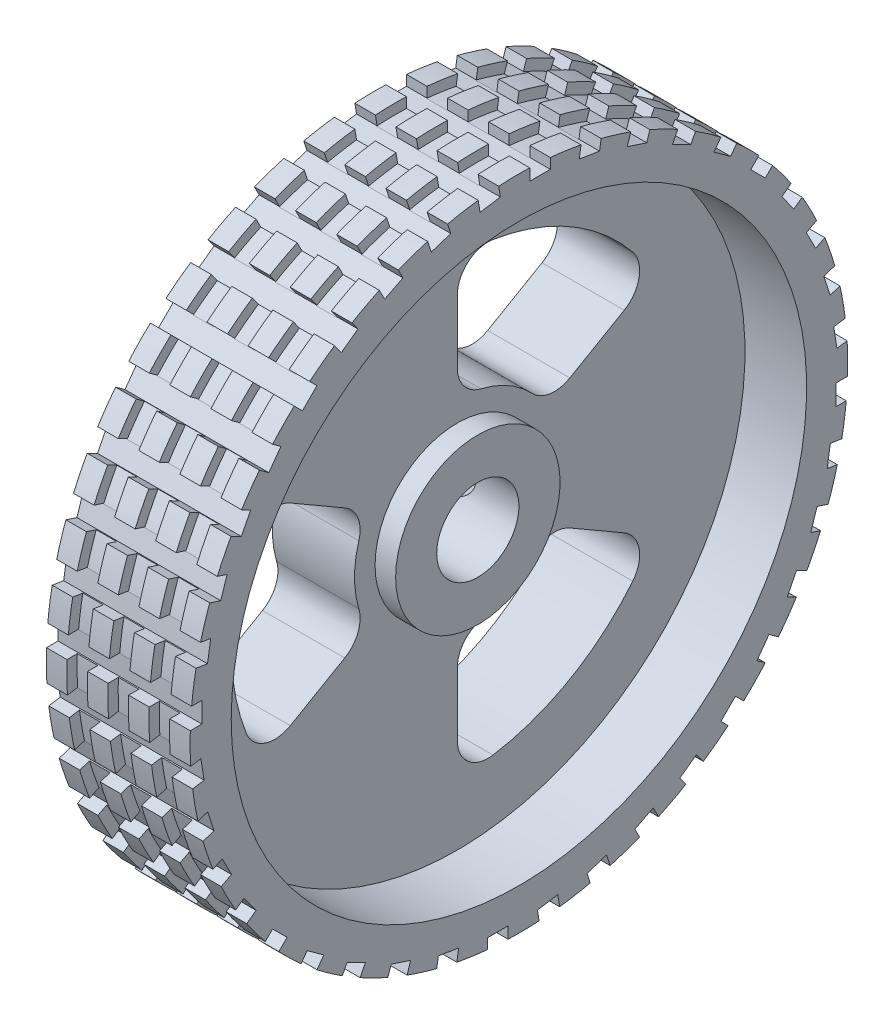
from build123d import *

# Parameters (mm, degrees)
CUT_EXTRUDE1_DEPTH = 23.978250743
CIRPATTERN1_COUNT  = 3
CUT_EXTRUDE2_DEPTH = 24.685438729
CIRPATTERN2_COUNT  = 40
SKETCH6_W          = 1
SKETCH6_H          = 0.5
LPATTERN1_COUNT    = 3
LPATTERN1_PITCH    = 2


with BuildPart() as part:
    # Sketch1 → Revolve1 (revolve)
    with BuildSketch(Plane.XY, mode=Mode.PRIVATE) as revolve1_sk:
        Polygon((0, 2), (5, 2), (5, 4), (4, 4), (4, 14), (7, 14), (7, 16), (0, 16), align=None)
    revolve(revolve1_sk.sketch.rotate(Axis((0, 0, 0), (1, 0, 0)), 90), axis=Axis((0, 0, 0), (1, 0, 0)))

    # Sketch2 → Cut-Revolve1 (revolve, cut)
    with BuildSketch(Plane(origin=(0, 0, 0), x_dir=(1, 0, 0), z_dir=(0, 1, 0)), mode=Mode.PRIVATE) as cut_revolve1_sk:
        Polygon((2.9, 0), (2.9, 11.5), (3.5, 11.5), (3.5, 16), (2, 16), (2, 0), align=None)
    revolve(cut_revolve1_sk.sketch.rotate(Axis((2, 0, -16), (0, 0, 1)), 180), axis=Axis((2, 0, -16), (0, 0, 1)), mode=Mode.SUBTRACT)

    # Sketch4 → Cut-Extrude1 (cut, through all)
    with BuildSketch(Plane(origin=(4, 0, 0), x_dir=(0, 0, -1), z_dir=(1, 0, 0))):
        with BuildLine():
            Line((-8.124038405, 4.69041576), (-5.477225575, 3.16227766))
            ThreePointArc((-5.477225575, 3.16227766), (-4.833247936, 2.417158631), (-4.790173519, 1.433261196))
            ThreePointArc((-4.790173519, 1.433261196), (-5, 0), (-4.790173519, -1.433261196))
            ThreePointArc((-4.790173519, -1.433261196), (-4.833247936, -2.417158631), (-5.477225575, -3.16227766))
            Line((-5.477225575, -3.16227766), (-8.124038405, -4.69041576))
            ThreePointArc((-8.124038405, -4.69041576), (-9.375793933, -4.804969317), (-10.275202363, -3.926858336))
            ThreePointArc((-10.275202363, -3.926858336), (-11, 0), (-10.275202363, 3.926858336))
            ThreePointArc((-10.275202363, 3.926858336), (-9.375793933, 4.804969317), (-8.124038405, 4.69041576))
        make_face()
    cut_extrude1 = extrude(amount=-CUT_EXTRUDE1_DEPTH, mode=Mode.SUBTRACT)

    # CirPattern1: Cut-Extrude1 ×3 about axis
    cirpattern1_axis = Axis((0, 0, 0), (1, 0, 0))
    for i in range(1, CIRPATTERN1_COUNT):
        add(cut_extrude1.rotate(cirpattern1_axis, i * 360 / CIRPATTERN1_COUNT), mode=Mode.SUBTRACT)

    # Sketch5 → Cut-Extrude2 (cut, through all)
    with BuildSketch(Plane(origin=(7, 0, 0), x_dir=(0, 0, -1), z_dir=(1, 0, 0))):
        with BuildLine():
            Line((1.527323147, 15.926935801), (1.527323147, 15.426935801))
            Line((1.527323147, 15.426935801), (0.527323147, 15.426935801))
            Line((0.527323147, 15.426935801), (0.527323147, 15.991307961))
            ThreePointArc((0.527323147, 15.991307961), (1.027827219, 15.966952471), (1.527323147, 15.926935801))
        make_face()
    cut_extrude2 = extrude(amount=-CUT_EXTRUDE2_DEPTH, mode=Mode.SUBTRACT)

    # CirPattern2: Cut-Extrude2 ×40 about axis
    cirpattern2_axis = Axis((0, 0, 0), (1, 0, 0))
    for i in range(1, CIRPATTERN2_COUNT):
        add(cut_extrude2.rotate(cirpattern2_axis, i * 360 / CIRPATTERN2_COUNT), mode=Mode.SUBTRACT)

    # Sketch6 → Cut-Revolve2 (revolve, cut)
    with BuildSketch(Plane.XY):
        with Locations((5.5, 15.75)):
            Rectangle(SKETCH6_W, SKETCH6_H)
    cut_revolve2 = revolve(axis=Axis((0, 0, 0), (1, 0, 0)), mode=Mode.SUBTRACT)

    # LPattern1: Cut-Revolve2 ×3
    with Locations(*[(-i * LPATTERN1_PITCH, 0, 0) for i in range(1, LPATTERN1_COUNT)]):
        add(cut_revolve2, mode=Mode.SUBTRACT)


solid = part.part
